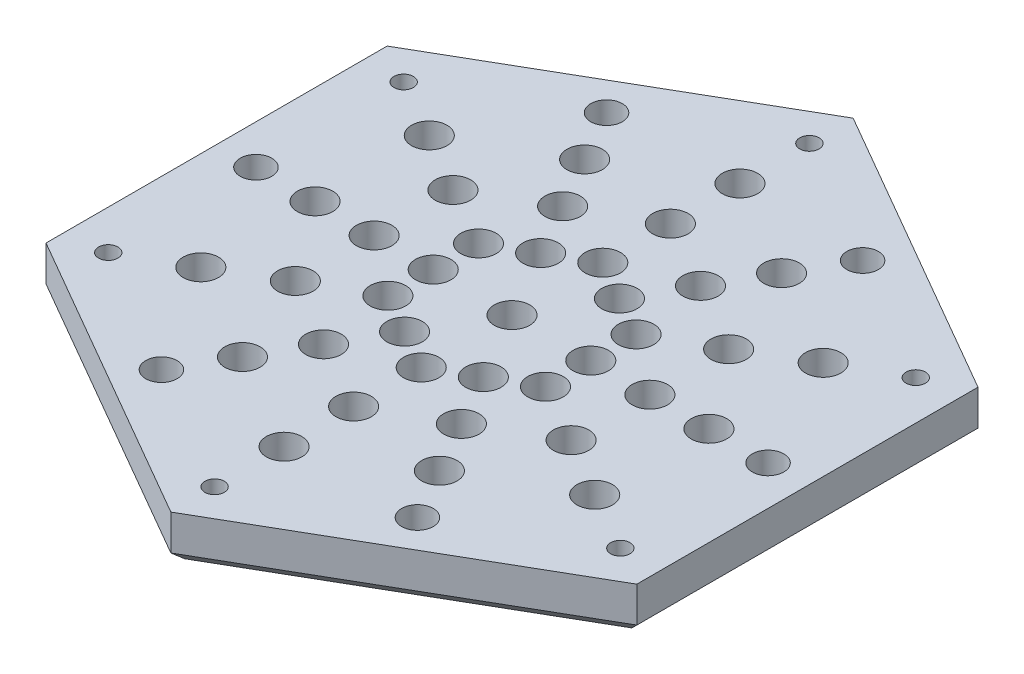
from build123d import *

# Parameters (mm, degrees)
EXTRUDE_1_DEPTH          = 12
CHAMFER_1_SIZE           = 3
SKETCH_2_R               = 4
EXTRUDE_2_DEPTH          = 12
HOLE_WIZARD_1_D          = 4.917
HOLE_WIZARD_1_DEPTH      = 17.1
HOLE_WIZARD_1_TIP        = 1.477215832
SKETCH_5_R               = 4.5
EXTRUDE_4_DEPTH          = 12
SKETCH_6_R               = 4.5
EXTRUDE_3_DEPTH          = 12
SKETCH_7_R               = 4.5
EXTRUDE_5_DEPTH          = 12
MIRROR_2_COPY_1_SKETCH_R = 4.5
MIRROR_2_COPY_1_DEPTH    = 12
SKETCH_8_R               = 4.5
EXTRUDE_8_DEPTH          = 12
SKETCH_9_R               = 4.5
EXTRUDE_9_DEPTH          = 12
MIRROR_8_COPY_1_SKETCH_R = 4.5
MIRROR_8_COPY_1_DEPTH    = 12


with BuildPart() as part:
    # 草圖1 → 擠出1 (new body)
    with BuildSketch(Plane(origin=(0, 0, 0), x_dir=(-1, 0, 0), z_dir=(0, 1, 0))):
        Polygon((0, -86.602540378), (-75, -43.301270189), (-75, 43.301270189), (0, 86.602540378), (75, 43.301270189), (75, -43.301270189), align=None)
    extrude(amount=EXTRUDE_1_DEPTH)

    # 倒角1
    chamfer_1_edges = [part.edges().sort_by_distance(p)[0] for p in [
        (37.5, 0, -64.951905284),
        (75, 0, 0),
        (37.5, 0, 64.951905284),
        (-37.5, 0, 64.951905284),
        (-75, 0, 0),
        (-37.5, 0, -64.951905284),
    ]]
    chamfer(chamfer_1_edges, length=CHAMFER_1_SIZE)

    # 草圖2 → 擠出2 (cut)
    with BuildSketch(Plane(origin=(0, 12, 0), x_dir=(-1, 0, 0), z_dir=(0, 1, 0))):
        with Locations(Location((-32.5, 56.5, 0), (0, 0, 90))):
            Circle(SKETCH_2_R)
        with Locations(Location((32.5, 56.5, 0), (0, 0, 90))):
            Circle(SKETCH_2_R)
        with Locations(Location((-65, 0, 0), (0, 0, 90))):
            Circle(SKETCH_2_R)
        with Locations(Location((-32.5, -56.5, 0), (0, 0, 90))):
            Circle(SKETCH_2_R)
        with Locations(Location((32.5, -56.5, 0), (0, 0, 90))):
            Circle(SKETCH_2_R)
        with Locations(Location((65, 0, 0), (0, 0, 90))):
            Circle(SKETCH_2_R)
    extrude(amount=-EXTRUDE_2_DEPTH, mode=Mode.SUBTRACT)

    # 孔1
    with Locations(Plane(origin=(0, 12, 0), x_dir=(1, 0, 0), z_dir=(0, 1, 0))):
        with Locations((0, 75.5), (-65, 37.5), (65, 37.5), (-65, -37.5), (65, -37.5), (0, -75.5)):
            Hole(HOLE_WIZARD_1_D / 2, depth=HOLE_WIZARD_1_DEPTH)
            with Locations((0, 0, -(HOLE_WIZARD_1_DEPTH + HOLE_WIZARD_1_TIP / 2))):  # 118° drill point
                Cone(0, HOLE_WIZARD_1_D / 2, HOLE_WIZARD_1_TIP, mode=Mode.SUBTRACT)

    # 草圖5 → 擠出4 (cut)
    with BuildSketch(Plane(origin=(0, 12, 0), x_dir=(-1, 0, 0), z_dir=(0, 1, 0))):
        with Locations(Location((0, 0, 0), (0, 0, 90))):
            Circle(SKETCH_5_R)
    extrude(amount=-EXTRUDE_4_DEPTH, mode=Mode.SUBTRACT)

    # 草圖6 → 擠出3 (cut)
    with BuildSketch(Plane(origin=(0, 12, 0), x_dir=(1, 0, 0), z_dir=(0, 1, 0))):
        with Locations(Location((20, 0, 0), (0, 0, 270))):
            Circle(SKETCH_6_R)
        with Locations(Location((35, 0, 0), (0, 0, 270))):
            Circle(SKETCH_6_R)
        with Locations(Location((50, 0, 0), (0, 0, 270))):
            Circle(SKETCH_6_R)
    extrude_3 = extrude(amount=-EXTRUDE_3_DEPTH, mode=Mode.SUBTRACT)

    # 鏡射5: 擠出3 across plane
    add(extrude_3.mirror(Plane(origin=(0, 0, 0), x_dir=(0, 0, 1), z_dir=(1, 0, 0))), mode=Mode.SUBTRACT)

    # 草圖7 → 擠出5 (cut)
    with BuildSketch(Plane(origin=(0, 12, 0), x_dir=(1, 0, 0), z_dir=(0, 1, 0))):
        with Locations(Location((20, 11.5, 0), (0, 0, 270))):
            Circle(SKETCH_7_R)
        with Locations(Location((35, 20, 0), (0, 0, 270))):
            Circle(SKETCH_7_R)
        with Locations(Location((50, 29, 0), (0, 0, 270))):
            Circle(SKETCH_7_R)
    extrude_5 = extrude(amount=-EXTRUDE_5_DEPTH, mode=Mode.SUBTRACT)

    # 鏡射1: 擠出5 across plane
    add(extrude_5.mirror(Plane.XY), mode=Mode.SUBTRACT)

    # 鏡射2: 擠出5 across plane
    add(extrude_5.mirror(Plane(origin=(0, 0, 0), x_dir=(0, 0, 1), z_dir=(1, 0, 0))), mode=Mode.SUBTRACT)

    # 鏡射2 copy 1 sketch → 鏡射2 copy 1 (cut)
    with BuildSketch(Plane(origin=(0, 12, 0), x_dir=(-1, 0, 0), z_dir=(0, 1, 0))):
        with Locations(Location((20, 11.5, 0), (0, 0, 270))):
            Circle(MIRROR_2_COPY_1_SKETCH_R)
        with Locations(Location((35, 20, 0), (0, 0, 270))):
            Circle(MIRROR_2_COPY_1_SKETCH_R)
        with Locations(Location((50, 29, 0), (0, 0, 270))):
            Circle(MIRROR_2_COPY_1_SKETCH_R)
    extrude(amount=-MIRROR_2_COPY_1_DEPTH, mode=Mode.SUBTRACT)

    # 草圖8 → 擠出8 (cut)
    with BuildSketch(Plane(origin=(0, 12, 0), x_dir=(1, 0, 0), z_dir=(0, 1, 0))):
        with Locations(Location((0, -23.047005384, 0), (0, 0, 270))):
            Circle(SKETCH_8_R)
        with Locations(Location((0, -40.207259422, 0), (0, 0, 270))):
            Circle(SKETCH_8_R)
        with Locations(Location((0, -57.867513459, 0), (0, 0, 270))):
            Circle(SKETCH_8_R)
    extrude_8 = extrude(amount=-EXTRUDE_8_DEPTH, mode=Mode.SUBTRACT)

    # 鏡射6: 擠出8 across plane
    add(extrude_8.mirror(Plane.XY), mode=Mode.SUBTRACT)

    # 草圖9 → 擠出9 (cut)
    with BuildSketch(Plane(origin=(0, 12, 0), x_dir=(1, 0, 0), z_dir=(0, 1, 0))):
        with Locations(Location((10, -17.273502692, 0), (0, 0, 270))):
            Circle(SKETCH_9_R)
        with Locations(Location((17.5, -30.353629711, 0), (0, 0, 270))):
            Circle(SKETCH_9_R)
        with Locations(Location((25, -43.43375673, 0), (0, 0, 270))):
            Circle(SKETCH_9_R)
    extrude_9 = extrude(amount=-EXTRUDE_9_DEPTH, mode=Mode.SUBTRACT)

    # 鏡射7: 擠出9 across plane
    add(extrude_9.mirror(Plane(origin=(0, 0, 0), x_dir=(0, 0, 1), z_dir=(1, 0, 0))), mode=Mode.SUBTRACT)

    # 鏡射8: 擠出9 across plane
    add(extrude_9.mirror(Plane.XY), mode=Mode.SUBTRACT)

    # 鏡射8 copy 1 sketch → 鏡射8 copy 1 (cut)
    with BuildSketch(Plane(origin=(0, 12, 0), x_dir=(-1, 0, 0), z_dir=(0, 1, 0))):
        with Locations(Location((10, -17.273502692, 0), (0, 0, 270))):
            Circle(MIRROR_8_COPY_1_SKETCH_R)
        with Locations(Location((17.5, -30.353629711, 0), (0, 0, 270))):
            Circle(MIRROR_8_COPY_1_SKETCH_R)
        with Locations(Location((25, -43.43375673, 0), (0, 0, 270))):
            Circle(MIRROR_8_COPY_1_SKETCH_R)
    extrude(amount=-MIRROR_8_COPY_1_DEPTH, mode=Mode.SUBTRACT)


solid = part.part
